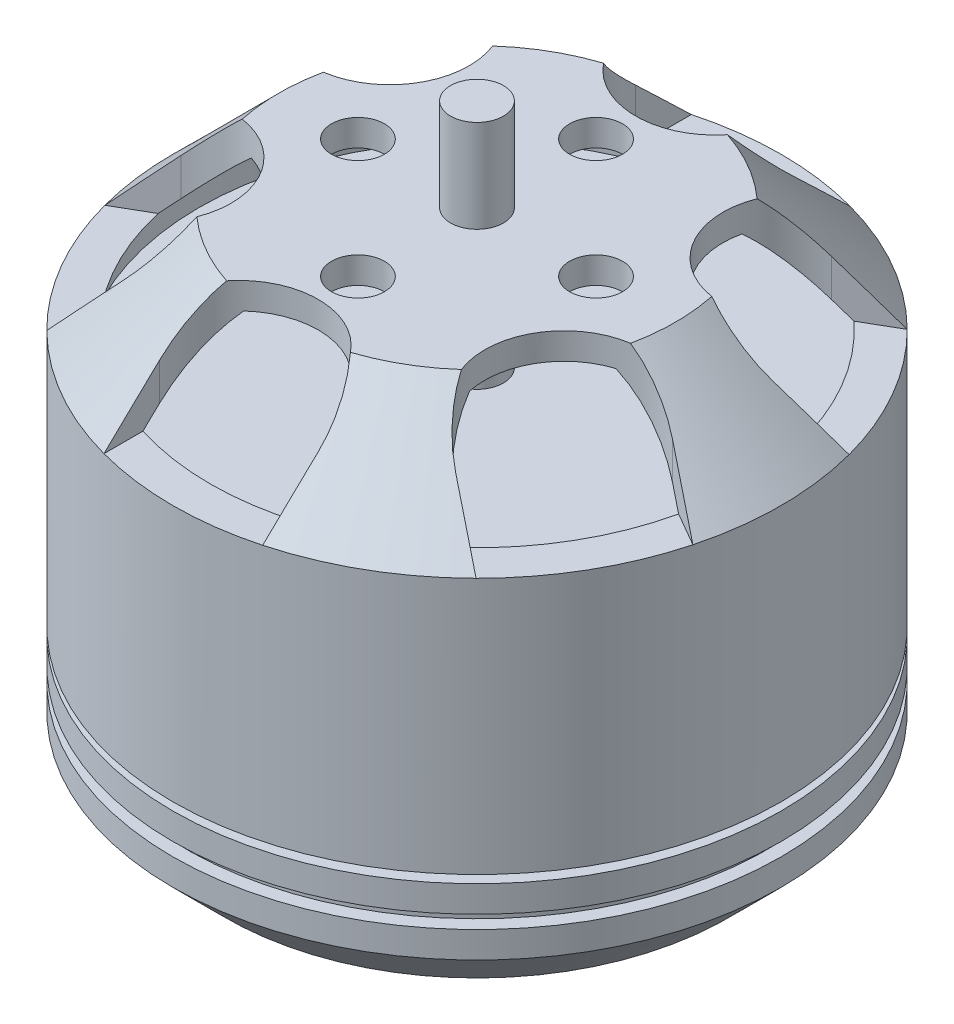
from build123d import *

# Parameters (mm, degrees)
SKETCH2_R          = 1
CUT_EXTRUDE1_DEPTH = 4
SKETCH3_R          = 1
CUT_EXTRUDE2_DEPTH = 3


with BuildPart() as part:
    # Sketch1 → Revolve1 (revolve)
    with BuildSketch(Plane.XY, mode=Mode.PRIVATE) as revolve1_sk:
        Polygon((0, 22), (0, -1.8), (1, -1.8), (1, 0), (9.5, 0), (11.5, 2), (11.5, 3), (11, 3), (11, 3.5), (11.5, 3.5), (11.5, 4.5), (9.5, 4.5), (9.5, 4.8), (11.5, 4.8), (11.5, 14.5), (7.5, 18.5), (1, 18.5), (1, 22), align=None)
        Polygon((2, 17.5), (7.085786438, 17.5), (10.5, 14.085786438), (10.5, 13.260583195), (1, 13.260583195), (1, 16.5), (2, 16.5), align=None, mode=Mode.SUBTRACT)
    revolve(revolve1_sk.sketch.rotate(Axis((0, 22, 0), (0, -1, 0)), 180), axis=Axis((0, 22, 0), (0, -1, 0)))

    # Sketch2 → Cut-Extrude1 (cut)
    with BuildSketch(Plane(origin=(0, 18.5, 0), x_dir=(1, 0, 0), z_dir=(0, 1, 0))):
        with Locations(Location((0, 4.5, 0), (0, 0, 180))):
            Circle(SKETCH2_R)
        with Locations(Location((4.5, 0, 0), (0, 0, 180))):
            Circle(SKETCH2_R)
        with Locations(Location((0, -4.5, 0), (0, 0, 180))):
            Circle(SKETCH2_R)
        with Locations(Location((-4.5, 0, 0), (0, 0, 180))):
            Circle(SKETCH2_R)
        with BuildLine():
            Line((-3, 9), (-3, 16.093948993))
            Line((-3, 16.093948993), (3, 16.093948993))
            Line((3, 16.093948993), (3, 9))
            ThreePointArc((3, 9), (0, 6), (-3, 9))
        make_face()
        with BuildLine():
            Line((15.437768675, 5.448898285), (9.294228634, 1.901923789))
            ThreePointArc((9.294228634, 1.901923789), (5.196152423, 3), (6.294228634, 7.098076211))
            Line((6.294228634, 7.098076211), (12.437768675, 10.645050708))
            Line((12.437768675, 10.645050708), (15.437768675, 5.448898285))
        make_face()
        with BuildLine():
            Line((12.437768675, -10.645050708), (6.294228634, -7.098076211))
            ThreePointArc((6.294228634, -7.098076211), (5.196152423, -3), (9.294228634, -1.901923789))
            Line((9.294228634, -1.901923789), (15.437768675, -5.448898285))
            Line((15.437768675, -5.448898285), (12.437768675, -10.645050708))
        make_face()
        with BuildLine():
            Line((-3, -16.093948993), (-3, -9))
            ThreePointArc((-3, -9), (0, -6), (3, -9))
            Line((3, -9), (3, -16.093948993))
            Line((3, -16.093948993), (-3, -16.093948993))
        make_face()
        with BuildLine():
            Line((-15.437768675, -5.448898285), (-9.294228634, -1.901923789))
            ThreePointArc((-9.294228634, -1.901923789), (-5.196152423, -3), (-6.294228634, -7.098076211))
            Line((-6.294228634, -7.098076211), (-12.437768675, -10.645050708))
            Line((-12.437768675, -10.645050708), (-15.437768675, -5.448898285))
        make_face()
        with BuildLine():
            Line((-12.437768675, 10.645050708), (-6.294228634, 7.098076211))
            ThreePointArc((-6.294228634, 7.098076211), (-5.196152423, 3), (-9.294228634, 1.901923789))
            Line((-9.294228634, 1.901923789), (-15.437768675, 5.448898285))
            Line((-15.437768675, 5.448898285), (-12.437768675, 10.645050708))
        make_face()
    extrude(amount=-CUT_EXTRUDE1_DEPTH, mode=Mode.SUBTRACT)

    # Sketch3 → Cut-Extrude2 (cut)
    with BuildSketch(Plane.XZ):
        with Locations((0, 6)):
            Circle(SKETCH3_R)
        with Locations((0, -6)):
            Circle(SKETCH3_R)
        with Locations((8, 0)):
            Circle(SKETCH3_R)
        with Locations((-8, 0)):
            Circle(SKETCH3_R)
    extrude(amount=-CUT_EXTRUDE2_DEPTH, mode=Mode.SUBTRACT)


solid = part.part
